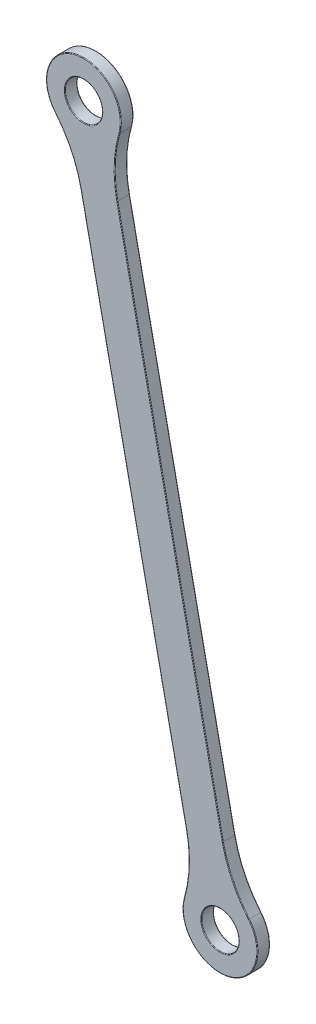
from build123d import *

# Parameters (mm, degrees)
BOSS_EXTRUDE1_DEPTH = 3
FILLET1_R           = 30
FILLET2_R           = 0.15


with BuildPart() as part:
    # Sketch1 → Boss-Extrude1 (new body)
    with BuildSketch(Plane.XY):
        with BuildLine():
            ThreePointArc((-6.886547335, 232.000014174), (-3.407947196, 237.329117389), (1.921156019, 233.85051725))
            Line((1.921156019, 233.85051725), (3.523738692, 226.222822397))
            ThreePointArc((3.523738692, 226.222822397), (5.734904635, 229.254973432), (6.517304342, 232.925265712))
            ThreePointArc((6.517304342, 232.925265712), (-7.76420013, 240.212632213), (-5.283964661, 224.372319321))
            Line((-5.283964661, 224.372319321), (-6.886547335, 232.000014174))
        make_face()
        with BuildLine():
            Line((3.523738692, 226.222822397), (1.921156019, 233.85051725))
            ThreePointArc((1.921156019, 233.85051725), (-1.55744412, 228.521414035), (-6.886547335, 232.000014174))
            Line((-6.886547335, 232.000014174), (-5.283964661, 224.372319321))
            ThreePointArc((-5.283964661, 224.372319321), (-0.632192582, 224.117562359), (3.523738692, 226.222822397))
        make_face()
        with BuildLine():
            Line((33.216405807, 84.89681915), (3.523738692, 226.222822397))
            ThreePointArc((3.523738692, 226.222822397), (-0.632192582, 224.117562359), (-5.283964661, 224.372319321))
            Line((-5.283964661, 224.372319321), (24.408702453, 83.046316074))
            ThreePointArc((24.408702453, 83.046316074), (28.564633728, 85.151576112), (33.216405807, 84.89681915))
        make_face()
        with BuildLine():
            ThreePointArc((39.415136803, 76.343872758), (37.702503304, 81.62537723), (33.216405807, 84.89681915))
            Line((33.216405807, 84.89681915), (34.81898848, 77.269124296))
            ThreePointArc((34.81898848, 77.269124296), (31.340388341, 71.940021082), (26.011285127, 75.41862122))
            Line((26.011285127, 75.41862122), (24.408702453, 83.046316074))
            ThreePointArc((24.408702453, 83.046316074), (26.744844523, 68.126272465), (39.415136803, 76.343872758))
        make_face()
        with BuildLine():
            Line((34.81898848, 77.269124296), (33.216405807, 84.89681915))
            ThreePointArc((33.216405807, 84.89681915), (28.564633728, 85.151576112), (24.408702453, 83.046316074))
            Line((24.408702453, 83.046316074), (26.011285127, 75.41862122))
            ThreePointArc((26.011285127, 75.41862122), (29.489885265, 80.747724435), (34.81898848, 77.269124296))
        make_face()
    extrude(amount=BOSS_EXTRUDE1_DEPTH)

    # Fillet1
    fillet1_edges = [part.edges().sort_by_distance(p)[0] for p in [
        (3.523738692, 226.222822397, 1.5),
        (33.216405807, 84.89681915, 1.5),
        (24.408702453, 83.046316074, 1.5),
        (-5.283964661, 224.372319321, 1.5),
    ]]
    fillet(fillet1_edges, radius=FILLET1_R)

    # Fillet2
    fillet2_edges = [part.edges().sort_by_distance(p)[0] for p in [
        (26.011285127, 75.41862122, 0),
        (-4.333198734, 241.732969066, 0),
        (-4.333198734, 241.732969066, 3),
        (18.37007225, 155.559820773, 0),
        (18.37007225, 155.559820773, 3),
        (9.562368896, 153.709317697, 0),
        (9.562368896, 153.709317697, 3),
        (29.16798629, 67.430701853, 0),
        (29.16798629, 67.430701853, 3),
        (5.038402355, 223.284945119, 0),
        (5.038402355, 223.284945119, 3),
        (-5.488250939, 221.073289763, 0),
        (1.921156019, 233.85051725, 3),
        (-5.488250939, 221.073289763, 3),
        (22.89403879, 85.984193351, 0),
        (22.89403879, 85.984193351, 3),
        (33.420692085, 88.195848708, 0),
        (33.420692085, 88.195848708, 3),
        (26.011285127, 75.41862122, 3),
        (1.921156019, 233.85051725, 0),
    ]]
    fillet(fillet2_edges, radius=FILLET2_R)


solid = part.part
